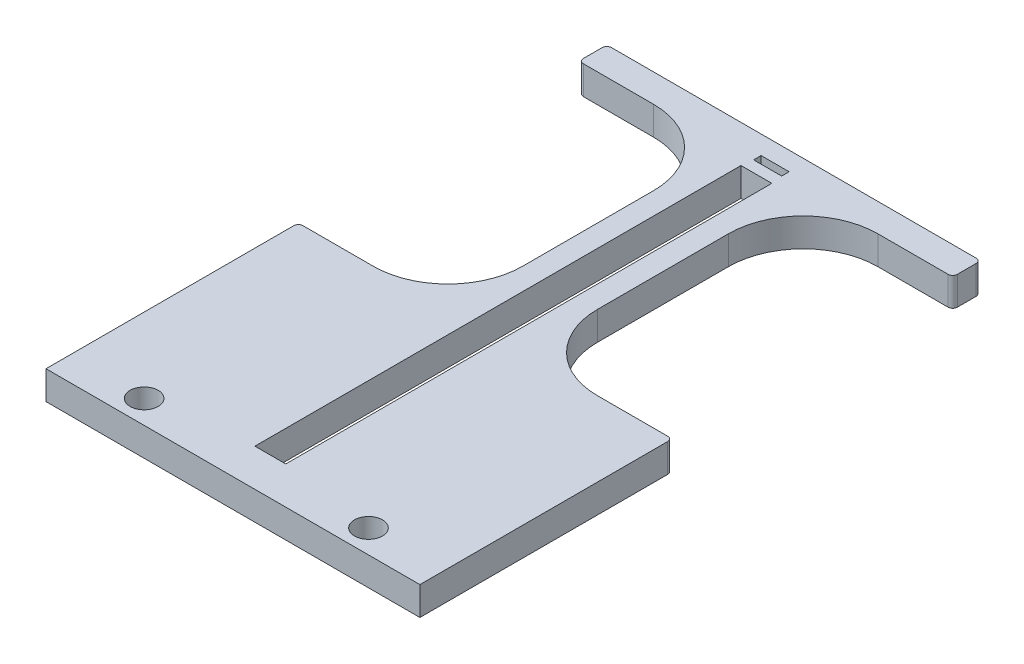
from build123d import *

# Parameters (mm, degrees)
SKETCH1_W           = 40
SKETCH1_H           = 60
BOSS_EXTRUDE1_DEPTH = 3.05
SKETCH4_W           = 3.3
SKETCH4_H           = 52
SKETCH4_W_2         = 3
SKETCH4_H_2         = 0.8
CUT_EXTRUDE1_DEPTH  = 10
SKETCH7_R           = 8
CUT_EXTRUDE4_DEPTH  = 10
SKETCH8_R           = 1.5
CUT_EXTRUDE5_DEPTH  = 10
FILLET1_R           = 0.5


with BuildPart() as part:
    # Sketch1 → Boss-Extrude1 (new body)
    with BuildSketch(Plane(origin=(0, 0, 0), x_dir=(1, 0, 0), z_dir=(0, 1, 0))):
        with Locations((20, 30)):
            Rectangle(SKETCH1_W, SKETCH1_H)
    extrude(amount=BOSS_EXTRUDE1_DEPTH)

    # Sketch4 → Cut-Extrude1 (cut)
    with BuildSketch(Plane(origin=(0, 3.05, 0), x_dir=(1, 0, 0), z_dir=(0, 1, 0))):
        with Locations((20, 30)):
            Rectangle(SKETCH4_W, SKETCH4_H)
        with Locations((20, 57.6)):
            Rectangle(SKETCH4_W_2, SKETCH4_H_2)
    extrude(amount=-CUT_EXTRUDE1_DEPTH, mode=Mode.SUBTRACT)

    # Sketch7 → Cut-Extrude4 (cut)
    with BuildSketch(Plane(origin=(0, 3.05, 0), x_dir=(1, 0, 0), z_dir=(0, 1, 0))):
        with Locations((8, 35)):
            Circle(SKETCH7_R)
        with Locations((8, 49)):
            Circle(SKETCH7_R)
        with BuildLine():
            Line((8, 57), (0, 57))
            Line((0, 57), (0, 49))
            ThreePointArc((0, 49), (2.343145751, 54.656854249), (8, 57))
        make_face()
        with BuildLine():
            Line((16, 35), (16, 49))
            ThreePointArc((16, 49), (14.891439137, 44.936987987), (11.872983346, 42))
            ThreePointArc((11.872983346, 42), (14.891439137, 39.063012013), (16, 35))
        make_face()
        with BuildLine():
            ThreePointArc((4.127016654, 42), (1.108560863, 44.936987987), (0, 49))
            Line((0, 49), (0, 35))
            ThreePointArc((0, 35), (1.108560863, 39.063012013), (4.127016654, 42))
        make_face()
        with BuildLine():
            ThreePointArc((8, 27), (2.343145751, 29.343145751), (0, 35))
            Line((0, 35), (0, 27))
            Line((0, 27), (8, 27))
        make_face()
        with BuildLine():
            ThreePointArc((28.127016654, 42), (25.108560863, 44.936987987), (24, 49))
            Line((24, 49), (24, 35))
            ThreePointArc((24, 35), (25.108560863, 39.063012013), (28.127016654, 42))
        make_face()
        with Locations((32, 35)):
            Circle(SKETCH7_R)
        with Locations((32, 49)):
            Circle(SKETCH7_R)
        with BuildLine():
            Line((40, 35), (40, 49))
            ThreePointArc((40, 49), (38.891439137, 44.936987987), (35.872983346, 42))
            ThreePointArc((35.872983346, 42), (38.891439137, 39.063012013), (40, 35))
        make_face()
        with BuildLine():
            Line((40, 27), (40, 35))
            ThreePointArc((40, 35), (37.656854263, 29.343145764), (32.000000039, 27))
            Line((32.000000039, 27), (40, 27))
        make_face()
        with BuildLine():
            Line((40, 49), (40, 57))
            Line((40, 57), (32, 57))
            ThreePointArc((32, 57), (37.656854249, 54.656854249), (40, 49))
        make_face()
    extrude(amount=-CUT_EXTRUDE4_DEPTH, mode=Mode.SUBTRACT)

    # Sketch8 → Cut-Extrude5 (cut)
    with BuildSketch(Plane(origin=(0, 3.05, 0), x_dir=(1, 0, 0), z_dir=(0, 1, 0))):
        with BuildLine():
            ThreePointArc((9.5, 2.5), (6.939339828, 3.560660172), (8, 1))
            Line((8, 1), (8, 2.5))
            Line((8, 2.5), (9.5, 2.5))
        make_face()
        with BuildLine():
            Line((8, 2.5), (8, 1))
            ThreePointArc((8, 1), (9.060660172, 1.439339828), (9.5, 2.5))
            Line((9.5, 2.5), (8, 2.5))
        make_face()
        with Locations(Location((32, 2.5, 0), (0, 0, 270))):
            Circle(SKETCH8_R)
    extrude(amount=-CUT_EXTRUDE5_DEPTH, mode=Mode.SUBTRACT)

    # Fillet1
    fillet1_edges = [part.edges().sort_by_distance(p)[0] for p in [
        (0, 1.525, -27),
        (0, 1.525, -57),
        (40, 1.525, -57),
        (40, 1.525, -27),
        (0, 1.525, -60),
        (40, 1.525, -60),
    ]]
    fillet(fillet1_edges, radius=FILLET1_R)


solid = part.part
